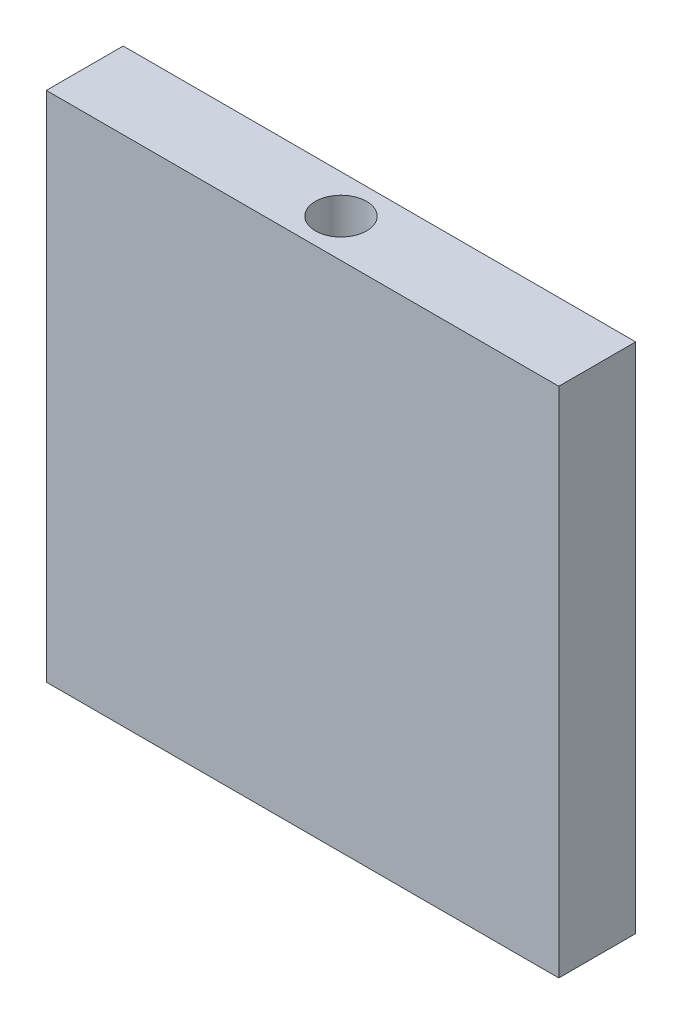
from build123d import *

# Parameters (mm, degrees)
SKETCH1_W           = 25.4
SKETCH1_H           = 3.81
SKETCH1_R           = 1.27
BOSS_EXTRUDE1_DEPTH = 25.4


with BuildPart() as part:
    # Sketch1 → Boss-Extrude1 (new body)
    with BuildSketch(Plane(origin=(0, 0, 0), x_dir=(1, 0, 0), z_dir=(0, 1, 0))):
        Rectangle(SKETCH1_W, SKETCH1_H)
        with Locations(Location((0, 0, 0), (0, 0, 270))):
            Circle(SKETCH1_R, mode=Mode.SUBTRACT)
    extrude(amount=BOSS_EXTRUDE1_DEPTH)


solid = part.part
